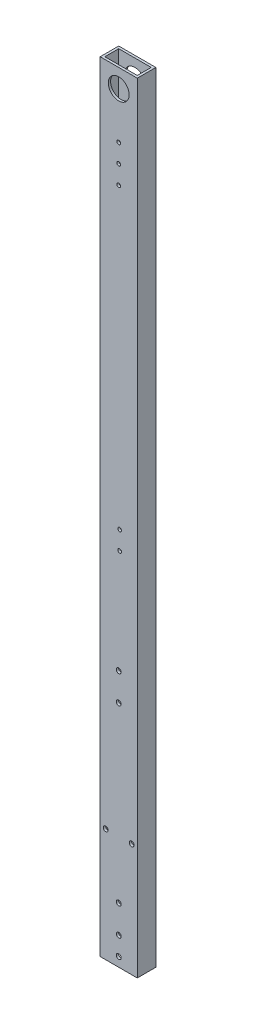
from build123d import *

# Parameters (mm, degrees)
SKETCH1_W                        = 50.8
SKETCH1_H                        = 25.4
SKETCH1_W_2                      = 44.45
SKETCH1_H_2                      = 19.05
BOSS_EXTRUDE1_DEPTH              = 1066.8
SKETCH2_R                        = 14.2875
CUT_EXTRUDE1_DEPTH               = 1068.404590584
SKETCH3_R                        = 3.3734375
CUT_EXTRUDE2_DEPTH               = 1068.404590584
SKETCH4_R                        = 3.3734375
CUT_EXTRUDE3_DEPTH               = 1068.404590584
SKETCH5_R                        = 3.3734375
CUT_EXTRUDE4_DEPTH               = 1068.404590584
F_13_64_0_20313_DIAMETER_HOLE1_D = 5.159502
F_13_64_0_20313_DIAMETER_HOLE2_D = 5.159502
SKETCH10_R                       = 3.3734375
CUT_EXTRUDE5_DEPTH               = 1068.404590584
SKETCH11_R                       = 3.3734375
CUT_EXTRUDE6_DEPTH               = 1068.404590584


with BuildPart() as part:
    # Sketch1 → Boss-Extrude1 (new body)
    with BuildSketch(Plane(origin=(0, 0, 0), x_dir=(1, 0, 0), z_dir=(0, 1, 0))):
        Rectangle(SKETCH1_W, SKETCH1_H)
        Rectangle(SKETCH1_W_2, SKETCH1_H_2, mode=Mode.SUBTRACT)
    extrude(amount=BOSS_EXTRUDE1_DEPTH)

    # Sketch2 → Cut-Extrude1 (cut, through all)
    with BuildSketch(Plane.XY.offset(12.7)):
        with Locations((0, 1041.4)):
            Circle(SKETCH2_R)
    extrude(amount=-CUT_EXTRUDE1_DEPTH, mode=Mode.SUBTRACT)

    # Sketch3 → Cut-Extrude2 (cut, through all)
    with BuildSketch(Plane.XY.offset(12.7)):
        with Locations((0, 313.436)):
            Circle(SKETCH3_R)
    extrude(amount=-CUT_EXTRUDE2_DEPTH, mode=Mode.SUBTRACT)

    # Sketch4 → Cut-Extrude3 (cut, through all)
    with BuildSketch(Plane.XY.offset(12.7)):
        with Locations((0, 351.536)):
            Circle(SKETCH4_R)
    extrude(amount=-CUT_EXTRUDE3_DEPTH, mode=Mode.SUBTRACT)

    # Sketch5 → Cut-Extrude4 (cut, through all)
    with BuildSketch(Plane.XY.offset(12.7)):
        with Locations((0, 12.7)):
            Circle(SKETCH5_R)
        with Locations((0, 38.1)):
            Circle(SKETCH5_R)
    extrude(amount=-CUT_EXTRUDE4_DEPTH, mode=Mode.SUBTRACT)

    # 13/64 (0.20313) Diameter Hole1 (through all)
    with Locations(Plane(origin=(0, 0, -12.7), x_dir=(-1, 0, 0), z_dir=(0, 0, -1))):
        with Locations((-1.269999999, 519.585439927), (-1.269999999, 494.185439927)):
            Hole(F_13_64_0_20313_DIAMETER_HOLE1_D / 2)

    # 13/64 (0.20313) Diameter Hole2 (through all)
    with Locations(Plane(origin=(0, 0, -12.7), x_dir=(-1, 0, 0), z_dir=(0, 0, -1))):
        with Locations((0, 977.9), (0, 952.5), (0, 927.1)):
            Hole(F_13_64_0_20313_DIAMETER_HOLE2_D / 2)

    # Sketch10 → Cut-Extrude5 (cut, through all)
    with BuildSketch(Plane(origin=(0, 0, -12.7), x_dir=(-1, 0, 0), z_dir=(0, 0, -1))):
        with Locations((0, 76.2)):
            Circle(SKETCH10_R)
    extrude(amount=-CUT_EXTRUDE5_DEPTH, mode=Mode.SUBTRACT)

    # Sketch11 → Cut-Extrude6 (cut, through all)
    with BuildSketch(Plane(origin=(0, 0, -12.7), x_dir=(-1, 0, 0), z_dir=(0, 0, -1))):
        with Locations((-17.779998161, 155.17537)):
            Circle(SKETCH11_R)
        with Locations((17.780001839, 155.17537)):
            Circle(SKETCH11_R)
    extrude(amount=-CUT_EXTRUDE6_DEPTH, mode=Mode.SUBTRACT)


solid = part.part
